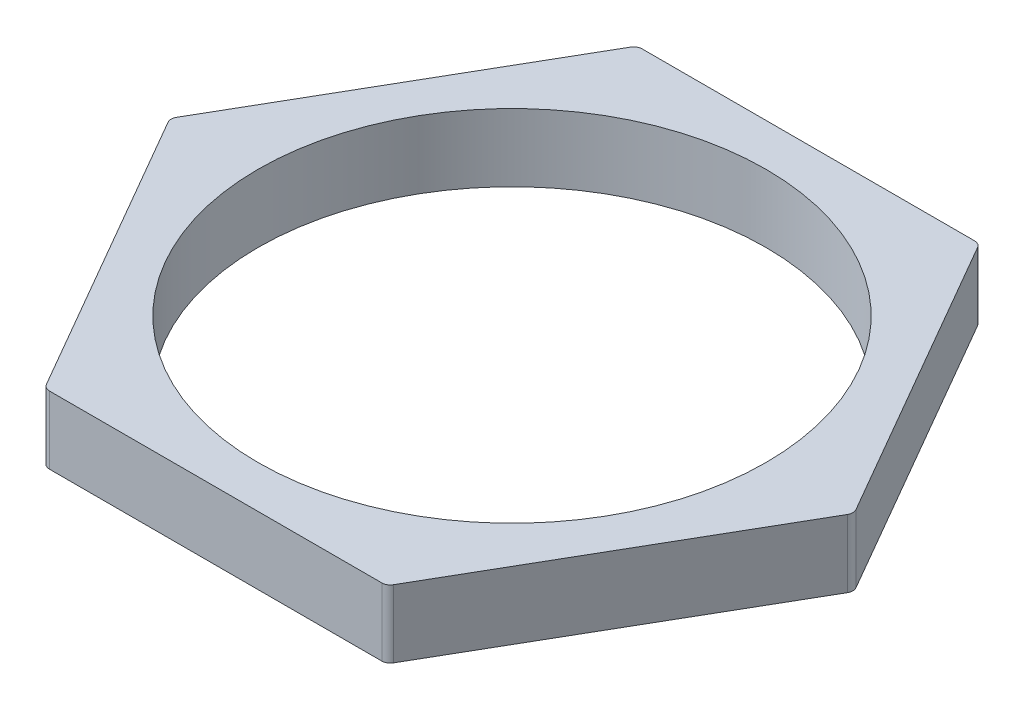
from build123d import *

# Parameters (mm, degrees)
CROQUIS1_R              = 15
SALIENTE_EXTRUIR1_DEPTH = 4


with BuildPart() as part:
    # Croquis1 → Saliente-Extruir1 (new body)
    with BuildSketch(Plane(origin=(0, 4, 0), x_dir=(1, 0, 0), z_dir=(0, 1, 0))):
        with BuildLine():
            Line((9.814954576, 17.5), (-9.814954576, 17.5))
            ThreePointArc((-9.814954576, 17.5), (-10.064954576, 17.433012702), (-10.247967278, 17.25))
            Line((-10.247967278, 17.25), (-20.062921854, 0.25))
            ThreePointArc((-20.062921854, 0.25), (-20.129909152, 0), (-20.062921854, -0.25))
            Line((-20.062921854, -0.25), (-10.247967278, -17.25))
            ThreePointArc((-10.247967278, -17.25), (-10.064954576, -17.433012702), (-9.814954576, -17.5))
            Line((-9.814954576, -17.5), (9.814954576, -17.5))
            ThreePointArc((9.814954576, -17.5), (10.064954576, -17.433012702), (10.247967278, -17.25))
            Line((10.247967278, -17.25), (20.062921854, -0.25))
            ThreePointArc((20.062921854, -0.25), (20.129909152, 0), (20.062921854, 0.25))
            Line((20.062921854, 0.25), (10.247967278, 17.25))
            ThreePointArc((10.247967278, 17.25), (10.064954576, 17.433012702), (9.814954576, 17.5))
        make_face()
        with Locations(Location((0, 0, 0), (0, 0, 90))):
            Circle(CROQUIS1_R, mode=Mode.SUBTRACT)
    extrude(amount=-SALIENTE_EXTRUIR1_DEPTH)


solid = part.part
